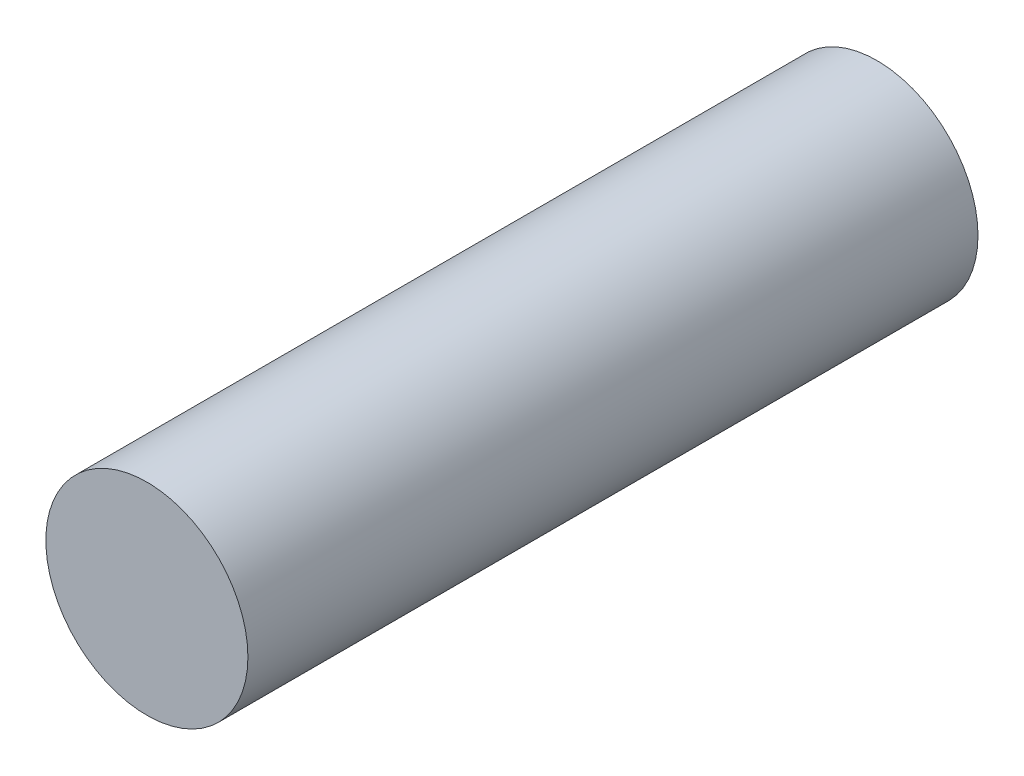
from build123d import *

# Parameters (mm, degrees)
SKETCH_1_R  = 3.8
CABLE_DEPTH = 27.459060435


with BuildPart() as part:
    # 草图1 → Cable (new body)
    with BuildSketch(Plane.XY):
        Circle(SKETCH_1_R)
    extrude(amount=CABLE_DEPTH)


solid = part.part
